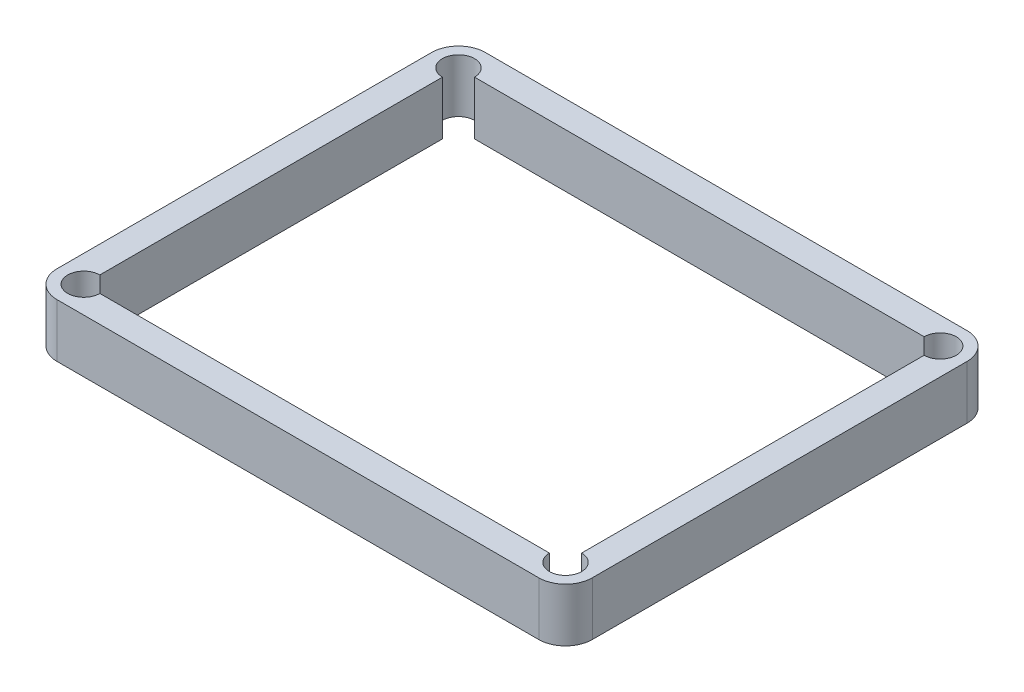
from build123d import *

# Parameters (mm, degrees)
EXTRUDE_3_DEPTH     = 5
SKETCH_7_R          = 1.5
CUT_EXTRUDE_1_DEPTH = 62.435637135
SKETCH_8_W          = 45
SKETCH_8_H          = 35
CUT_EXTRUDE_2_DEPTH = 62.435637135


with BuildPart() as part:
    # 草图1 → 凸台-拉伸3 (new body)
    with BuildSketch(Plane(origin=(0, 0, 0), x_dir=(1, 0, 0), z_dir=(0, 1, 0))):
        with BuildLine():
            Line((-55.213994356, 19.544380587), (-10.213994356, 19.544380587))
            ThreePointArc((-10.213994356, 19.544380587), (-8.446227403, 18.81214754), (-7.713994356, 17.044380587))
            Line((-7.713994356, 17.044380587), (-7.713994356, -17.955619413))
            ThreePointArc((-7.713994356, -17.955619413), (-8.446227403, -19.723386366), (-10.213994356, -20.455619413))
            Line((-10.213994356, -20.455619413), (-55.213994356, -20.455619413))
            ThreePointArc((-55.213994356, -20.455619413), (-56.981761309, -19.723386366), (-57.713994356, -17.955619413))
            Line((-57.713994356, -17.955619413), (-57.713994356, 17.044380587))
            ThreePointArc((-57.713994356, 17.044380587), (-56.981761309, 18.81214754), (-55.213994356, 19.544380587))
        make_face()
    extrude(amount=EXTRUDE_3_DEPTH)

    # 草图7 → 切除-拉伸1 (cut, through all)
    with BuildSketch(Plane(origin=(0, 5, 0), x_dir=(1, 0, 0), z_dir=(0, 1, 0))):
        with Locations(Location((-55.213994356, 17.044380587, 0), (0, 0, 270))):
            Circle(SKETCH_7_R)
        with Locations(Location((-10.213994356, 17.044380587, 0), (0, 0, 270))):
            Circle(SKETCH_7_R)
        with Locations(Location((-55.213994356, -17.955619413, 0), (0, 0, 270))):
            Circle(SKETCH_7_R)
        with Locations(Location((-10.213994356, -17.955619413, 0), (0, 0, 270))):
            Circle(SKETCH_7_R)
    extrude(amount=-CUT_EXTRUDE_1_DEPTH, mode=Mode.SUBTRACT)

    # 草图8 → 切除-拉伸2 (cut, through all)
    with BuildSketch(Plane(origin=(0, 5, 0), x_dir=(1, 0, 0), z_dir=(0, 1, 0))):
        with Locations((-32.713994356, -0.455619413)):
            Rectangle(SKETCH_8_W, SKETCH_8_H)
    extrude(amount=-CUT_EXTRUDE_2_DEPTH, mode=Mode.SUBTRACT)


solid = part.part
